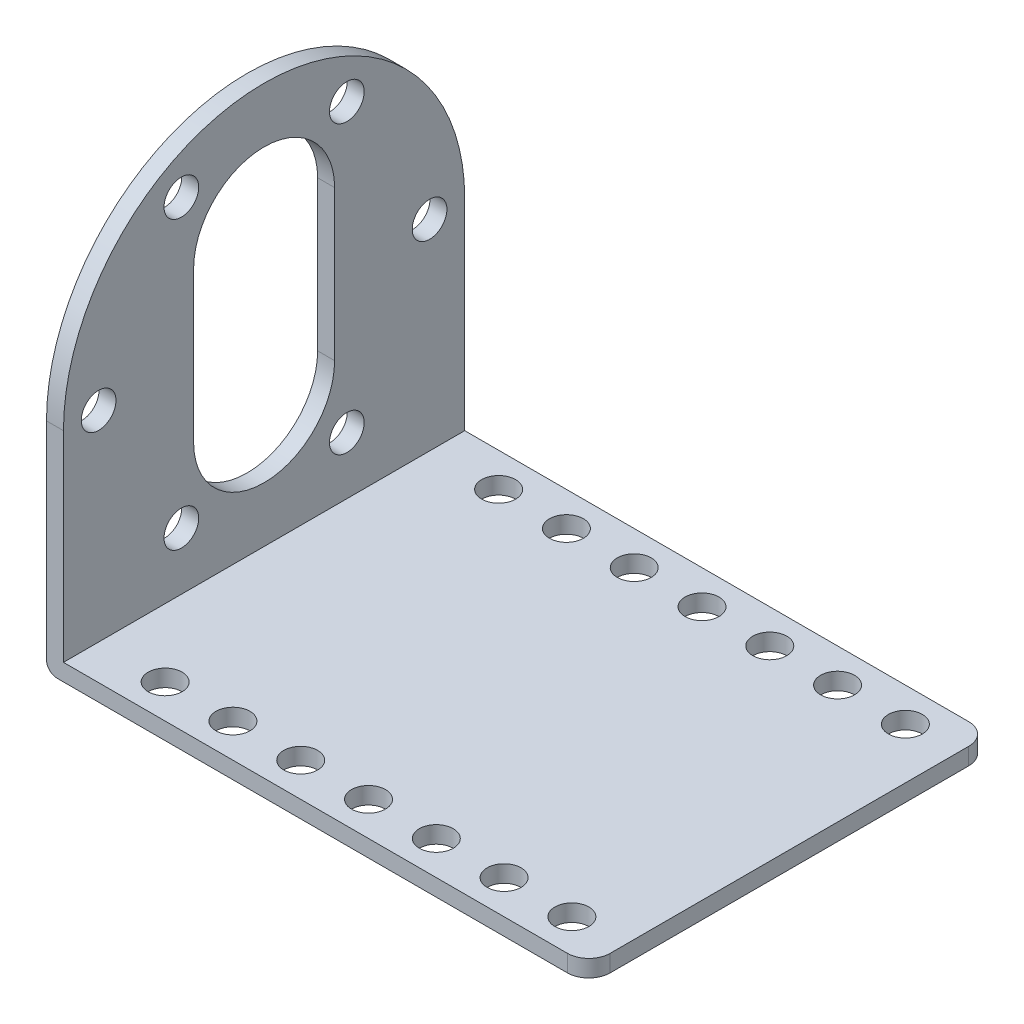
from build123d import *

# Parameters (mm, degrees)
ESQUISSE1_W             = 50.8
ESQUISSE1_H             = 37.59
BOSS_EXTRU_1_DEPTH      = 1.59
ESQUISSE2_W             = 1.59
ESQUISSE2_H             = 37.59
BOSS_EXTRU_2_DEPTH      = 37.59
CONG_1_R                = 1
ESQUISSE3_R             = 1.59
ENL_V_MAT_EXTRU_1_DEPTH = 74.52996804
CONG_2_R                = 2
ENL_V_MAT_EXTRU_2_DEPTH = 74.278268266
ESQUISSE5_R             = 1.625
ENL_V_MAT_EXTRU_3_DEPTH = 74.278268266


with BuildPart() as part:
    # Esquisse1 → Boss.-Extru.1 (new body)
    with BuildSketch(Plane(origin=(0, 0, 0), x_dir=(1, 0, 0), z_dir=(0, 1, 0))):
        with Locations((25.4, 18.795)):
            Rectangle(ESQUISSE1_W, ESQUISSE1_H)
    extrude(amount=BOSS_EXTRU_1_DEPTH)

    # Esquisse2 → Boss.-Extru.2 (add)
    with BuildSketch(Plane(origin=(0, 1.59, 0), x_dir=(-1, 0, 0), z_dir=(0, 1, 0))):
        with Locations((-0.795, -18.795)):
            Rectangle(ESQUISSE2_W, ESQUISSE2_H)
    extrude(amount=BOSS_EXTRU_2_DEPTH)

    # Congé1
    cong_1_edges = [part.edges().sort_by_distance(p)[0] for p in [
        (0, 0, -18.795),
    ]]
    fillet(cong_1_edges, radius=CONG_1_R)

    # Esquisse3 → Enlèv. mat.-Extru.1 (cut, through all)
    with BuildSketch(Plane(origin=(0, 1.59, 0), x_dir=(1, 0, 0), z_dir=(0, 1, 0))):
        with Locations(Location((7.94, 34.415, 0), (0, 0, 270))):
            Circle(ESQUISSE3_R)
        with Locations(Location((14.29, 34.415, 0), (0, 0, 270))):
            Circle(ESQUISSE3_R)
        with Locations(Location((20.64, 34.415, 0), (0, 0, 270))):
            Circle(ESQUISSE3_R)
        with Locations(Location((26.99, 34.415, 0), (0, 0, 270))):
            Circle(ESQUISSE3_R)
        with Locations(Location((33.34, 34.415, 0), (0, 0, 270))):
            Circle(ESQUISSE3_R)
        with Locations(Location((39.69, 34.415, 0), (0, 0, 270))):
            Circle(ESQUISSE3_R)
        with Locations(Location((46.04, 34.415, 0), (0, 0, 270))):
            Circle(ESQUISSE3_R)
        with Locations(Location((46.04, 3.175, 0), (0, 0, 270))):
            Circle(ESQUISSE3_R)
        with Locations(Location((39.69, 3.175, 0), (0, 0, 270))):
            Circle(ESQUISSE3_R)
        with Locations(Location((33.34, 3.175, 0), (0, 0, 270))):
            Circle(ESQUISSE3_R)
        with Locations(Location((26.99, 3.175, 0), (0, 0, 270))):
            Circle(ESQUISSE3_R)
        with Locations(Location((20.64, 3.175, 0), (0, 0, 270))):
            Circle(ESQUISSE3_R)
        with Locations(Location((14.29, 3.175, 0), (0, 0, 270))):
            Circle(ESQUISSE3_R)
        with Locations(Location((7.94, 3.175, 0), (0, 0, 270))):
            Circle(ESQUISSE3_R)
    extrude(amount=-ENL_V_MAT_EXTRU_1_DEPTH, mode=Mode.SUBTRACT)

    # Congé2
    cong_2_edges = [part.edges().sort_by_distance(p)[0] for p in [
        (50.8, 0.795, 0),
        (50.8, 0.795, -37.59),
    ]]
    fillet(cong_2_edges, radius=CONG_2_R)

    # Esquisse4 → Enlèv. mat.-Extru.2 (cut, through all)
    with BuildSketch(Plane(origin=(1.59, 0, 0), x_dir=(0, 0, -1), z_dir=(1, 0, 0))):
        with BuildLine():
            Line((0, 39.18), (0, 20.385))
            ThreePointArc((0, 20.385), (5.504928048, 33.675071952), (18.795, 39.18))
            Line((18.795, 39.18), (0, 39.18))
        make_face()
        with BuildLine():
            Line((37.59, 39.18), (18.795, 39.18))
            ThreePointArc((18.795, 39.18), (32.085071952, 33.675071952), (37.59, 20.385))
            Line((37.59, 20.385), (37.59, 39.18))
        make_face()
    extrude(amount=-ENL_V_MAT_EXTRU_2_DEPTH, mode=Mode.SUBTRACT)

    # Esquisse5 → Enlèv. mat.-Extru.3 (cut, through all)
    with BuildSketch(Plane(origin=(1.59, 0, 0), x_dir=(0, 0, -1), z_dir=(1, 0, 0))):
        with Locations((34.295, 20.385)):
            Circle(ESQUISSE5_R)
        with Locations((26.545, 6.961606241)):
            Circle(ESQUISSE5_R)
        with Locations((11.045, 6.961606241)):
            Circle(ESQUISSE5_R)
        with Locations((3.295, 20.385)):
            Circle(ESQUISSE5_R)
        with Locations((11.045, 33.808393759)):
            Circle(ESQUISSE5_R)
        with Locations((26.545, 33.808393759)):
            Circle(ESQUISSE5_R)
        with BuildLine():
            Line((12.19, 13.365), (12.19, 27.405))
            ThreePointArc((12.19, 27.405), (18.795, 34.01), (25.4, 27.405))
            Line((25.4, 27.405), (25.4, 13.365))
            ThreePointArc((25.4, 13.365), (18.795, 6.76), (12.19, 13.365))
        make_face()
    extrude(amount=-ENL_V_MAT_EXTRU_3_DEPTH, mode=Mode.SUBTRACT)


solid = part.part
